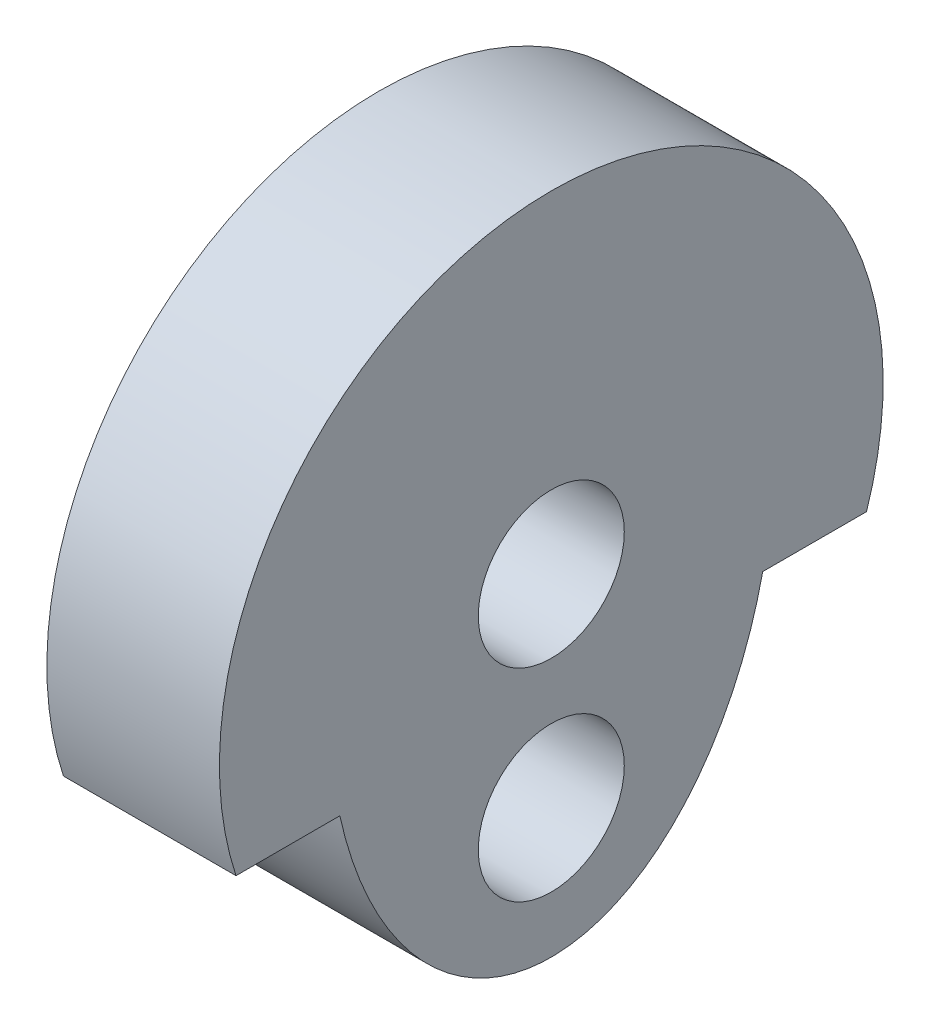
from build123d import *

# Parameters (mm, degrees)
BOSS_EXTRUDE1_DEPTH             = 13
M10_CLEARANCE_HOLE2_D           = 11
M10_CLEARANCE_HOLE2_ON_FACE_2_D = 11
M10_CLEARANCE_HOLE1_D           = 11


with BuildPart() as part:
    # Sketch1 → Boss-Extrude1 (new body)
    with BuildSketch(Plane(origin=(0, 0, 0), x_dir=(0, 0, -1), z_dir=(1, 0, 0))):
        with BuildLine():
            Line((-23.749988068, -7.8062838), (-15.929764022, -7.8062838))
            add(Edge.make_bspline(
                [(-15.929764022, -7.8062838), (0, -80.063704579), (15.929764022, -7.8062838)],
                knots=[5.029950938, 5.029950938, 5.029950938, 7.536419676, 7.536419676, 7.536419676], degree=2, weights=[1, 0.312251352, 1]))
            Line((15.929764022, -7.8062838), (23.749988068, -7.8062838))
            ThreePointArc((23.749988068, -7.8062838), (0, 25), (-23.749988068, -7.8062838))
        make_face()
    extrude(amount=BOSS_EXTRUDE1_DEPTH)

    # M10 Clearance Hole2 (through all)
    with Locations(Plane(origin=(0, 0, 0), x_dir=(0, 0, -1), z_dir=(-1, 0, 0))):
        with Locations((0, 0)):
            Hole(M10_CLEARANCE_HOLE2_D / 2)

    # M10 Clearance Hole2 on face 2 (through all)
    with Locations(Plane(origin=(13, 0, 0), x_dir=(0, 0, 1), z_dir=(1, 0, 0))):
        with Locations((0, 0)):
            Hole(M10_CLEARANCE_HOLE2_ON_FACE_2_D / 2)

    # M10 Clearance Hole1 (through all)
    with Locations(Plane(origin=(13, -15.25, 0), x_dir=(0, 0, 1), z_dir=(1, 0, 0))):
        with Locations((0, 0)):
            Hole(M10_CLEARANCE_HOLE1_D / 2)


solid = part.part
